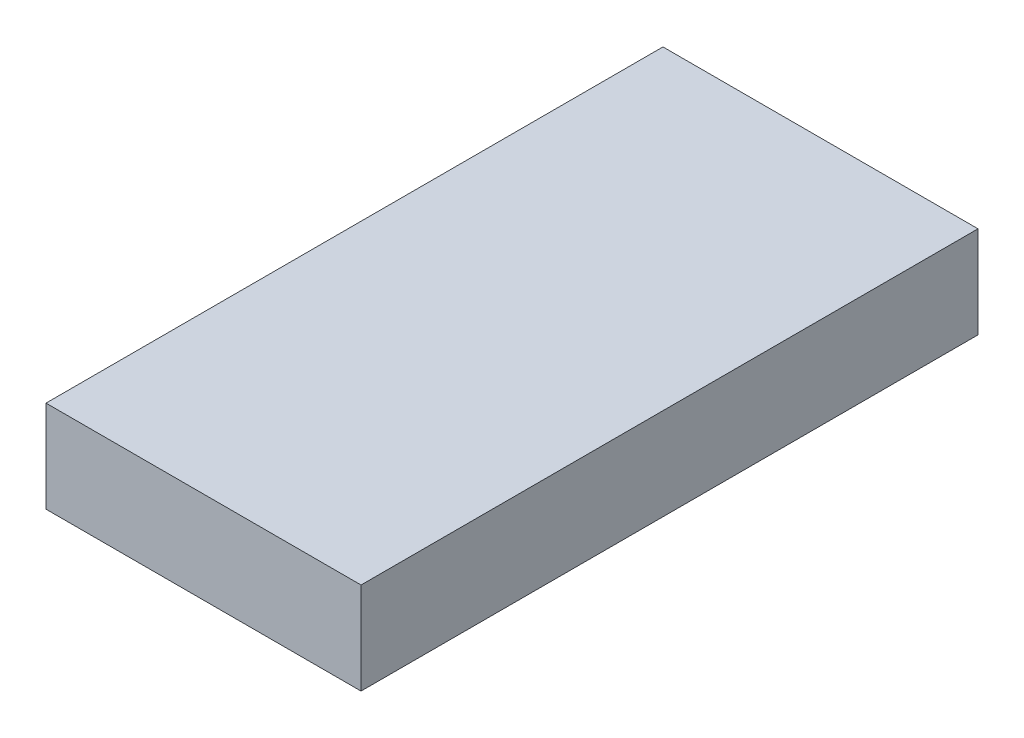
from build123d import *

# Parameters (mm, degrees)
SKETCH1_W           = 121.92
SKETCH1_H           = 35.56
BOSS_EXTRUDE1_DEPTH = 238.76


with BuildPart() as part:
    # Sketch1 → Boss-Extrude1 (new body)
    with BuildSketch(Plane.XY):
        Rectangle(SKETCH1_W, SKETCH1_H)
    extrude(amount=BOSS_EXTRUDE1_DEPTH)


solid = part.part
